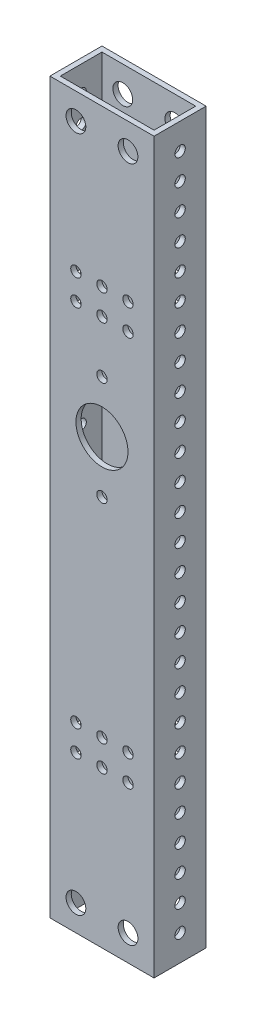
from build123d import *

# Parameters (mm, degrees)
SKETCH1_W           = 50.8
SKETCH1_H           = 25.4
SKETCH1_W_2         = 45.72
SKETCH1_H_2         = 20.32
BOSS_EXTRUDE1_DEPTH = 355.6
SKETCH2_R           = 2.54
CUT_EXTRUDE2_DEPTH  = 355.6
SKETCH3_R           = 4.826
SKETCH3_R_2         = 2.54
SKETCH3_R_3         = 12.7
CUT_EXTRUDE3_DEPTH  = 355.6


with BuildPart() as part:
    # Sketch1 → Boss-Extrude1 (new body)
    with BuildSketch(Plane(origin=(0, 0, 0), x_dir=(1, 0, 0), z_dir=(0, 1, 0))):
        with Locations((-23.021504389, 9.552608696)):
            Rectangle(SKETCH1_W, SKETCH1_H)
        with Locations((-23.021504389, 9.552608696)):
            Rectangle(SKETCH1_W_2, SKETCH1_H_2, mode=Mode.SUBTRACT)
    extrude(amount=BOSS_EXTRUDE1_DEPTH)

    # Sketch2 → Cut-Extrude2 (cut)
    with BuildSketch(Plane(origin=(2.378495611, 0, 0), x_dir=(0, 0, -1), z_dir=(1, 0, 0))):
        with Locations((9.552608696, 342.9)):
            Circle(SKETCH2_R)
        with Locations((9.552608696, 330.2)):
            Circle(SKETCH2_R)
        with Locations((9.552608696, 317.5)):
            Circle(SKETCH2_R)
        with Locations((9.552608696, 304.8)):
            Circle(SKETCH2_R)
        with Locations((9.552608696, 292.1)):
            Circle(SKETCH2_R)
        with Locations((9.552608696, 279.4)):
            Circle(SKETCH2_R)
        with Locations((9.552608696, 266.7)):
            Circle(SKETCH2_R)
        with Locations((9.552608696, 254)):
            Circle(SKETCH2_R)
        with Locations((9.552608696, 241.3)):
            Circle(SKETCH2_R)
        with Locations((9.552608696, 228.6)):
            Circle(SKETCH2_R)
        with Locations((9.552608696, 215.9)):
            Circle(SKETCH2_R)
        with Locations((9.552608696, 203.2)):
            Circle(SKETCH2_R)
        with Locations((9.552608696, 190.5)):
            Circle(SKETCH2_R)
        with Locations((9.552608696, 177.8)):
            Circle(SKETCH2_R)
        with Locations((9.552608696, 165.1)):
            Circle(SKETCH2_R)
        with Locations((9.552608696, 152.4)):
            Circle(SKETCH2_R)
        with Locations((9.552608696, 139.7)):
            Circle(SKETCH2_R)
        with Locations((9.552608696, 127)):
            Circle(SKETCH2_R)
        with Locations((9.552608696, 114.3)):
            Circle(SKETCH2_R)
        with Locations((9.552608696, 101.6)):
            Circle(SKETCH2_R)
        with Locations((9.552608696, 88.9)):
            Circle(SKETCH2_R)
        with Locations((9.552608696, 76.2)):
            Circle(SKETCH2_R)
        with Locations((9.552608696, 63.5)):
            Circle(SKETCH2_R)
        with Locations((9.552608696, 50.8)):
            Circle(SKETCH2_R)
        with Locations((9.552608696, 38.1)):
            Circle(SKETCH2_R)
        with Locations((9.552608696, 25.4)):
            Circle(SKETCH2_R)
        with Locations((9.552608696, 12.7)):
            Circle(SKETCH2_R)
    extrude(amount=-CUT_EXTRUDE2_DEPTH, mode=Mode.SUBTRACT)

    # Sketch3 → Cut-Extrude3 (cut)
    with BuildSketch(Plane(origin=(0, 0, -22.252608696), x_dir=(-1, 0, 0), z_dir=(0, 0, -1))):
        with Locations((10.321504389, 342.9)):
            Circle(SKETCH3_R)
        with Locations((35.721504389, 342.9)):
            Circle(SKETCH3_R)
        with Locations((10.321504389, 279.4)):
            Circle(SKETCH3_R_2)
        with Locations((23.021504389, 279.4)):
            Circle(SKETCH3_R_2)
        with Locations((35.721504389, 279.4)):
            Circle(SKETCH3_R_2)
        with Locations((10.321504389, 266.7)):
            Circle(SKETCH3_R_2)
        with Locations((23.021504389, 266.7)):
            Circle(SKETCH3_R_2)
        with Locations((35.721504389, 266.7)):
            Circle(SKETCH3_R_2)
        with Locations((23.021504389, 241.3)):
            Circle(SKETCH3_R_2)
        with Locations((23.021504389, 215.9)):
            Circle(SKETCH3_R_3)
        with Locations((23.021504389, 190.5)):
            Circle(SKETCH3_R_2)
        with Locations((35.721504389, 88.9)):
            Circle(SKETCH3_R_2)
        with Locations((23.021504389, 88.9)):
            Circle(SKETCH3_R_2)
        with Locations((10.321504389, 88.9)):
            Circle(SKETCH3_R_2)
        with Locations((10.321504389, 76.2)):
            Circle(SKETCH3_R_2)
        with Locations((23.021504389, 76.2)):
            Circle(SKETCH3_R_2)
        with Locations((35.721504389, 76.2)):
            Circle(SKETCH3_R_2)
        with Locations((35.721504389, 12.7)):
            Circle(SKETCH3_R)
        with Locations((10.321504389, 12.7)):
            Circle(SKETCH3_R)
    extrude(amount=-CUT_EXTRUDE3_DEPTH, mode=Mode.SUBTRACT)


solid = part.part
